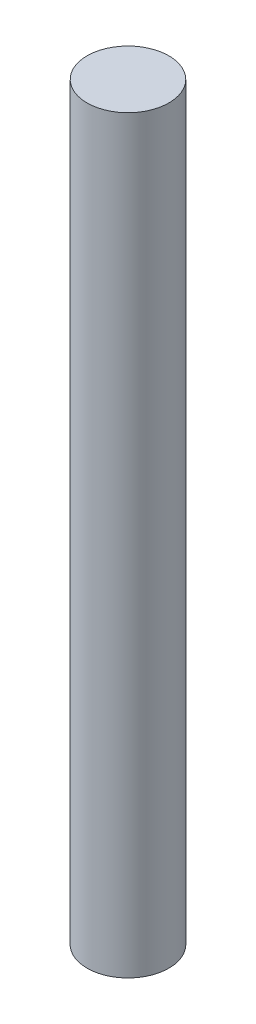
from build123d import *

# Parameters (mm, degrees)
SKETCH1_R           = 1.5
BOSS_EXTRUDE1_DEPTH = 13.75


with BuildPart() as part:
    # Sketch1 → Boss-Extrude1 (new, symmetric)
    with BuildSketch(Plane(origin=(0, 0, 0), x_dir=(1, 0, 0), z_dir=(0, 1, 0))):
        with Locations(Location((0, 0, 0), (0, 0, 270))):
            Circle(SKETCH1_R)
    extrude(amount=BOSS_EXTRUDE1_DEPTH, both=True)


solid = part.part
